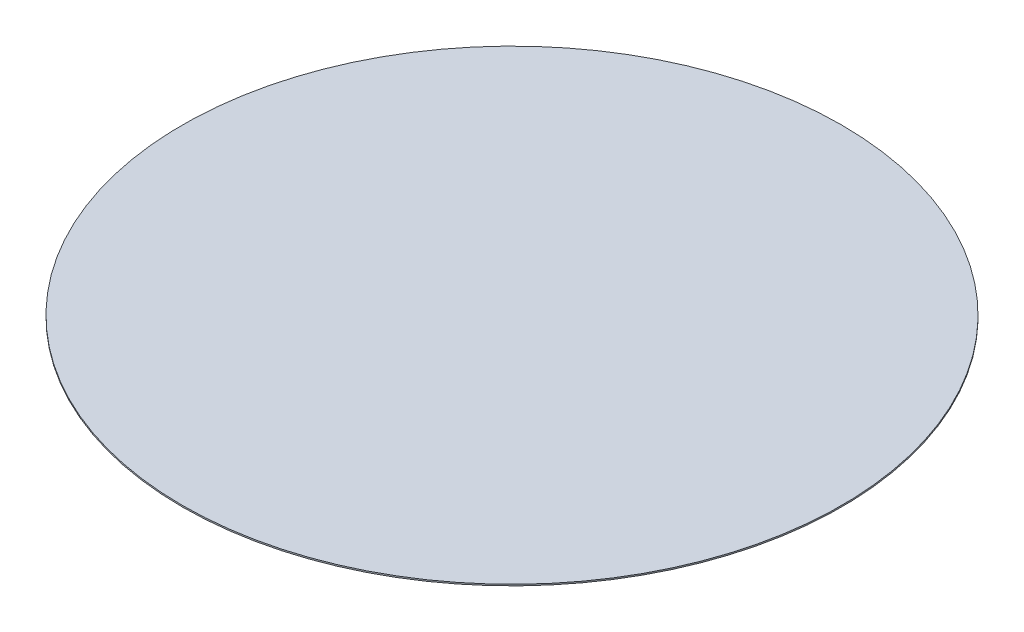
from build123d import *

# Parameters (mm, degrees)
SKETCH1_R           = 140
BOSS_EXTRUDE1_DEPTH = 0.6


with BuildPart() as part:
    # Sketch1 → Boss-Extrude1 (new body)
    with BuildSketch(Plane(origin=(0, 0, 0), x_dir=(1, 0, 0), z_dir=(0, 1, 0))):
        with Locations(Location((0, 0, 0), (0, 0, 270))):
            Circle(SKETCH1_R)
    extrude(amount=BOSS_EXTRUDE1_DEPTH)


solid = part.part
